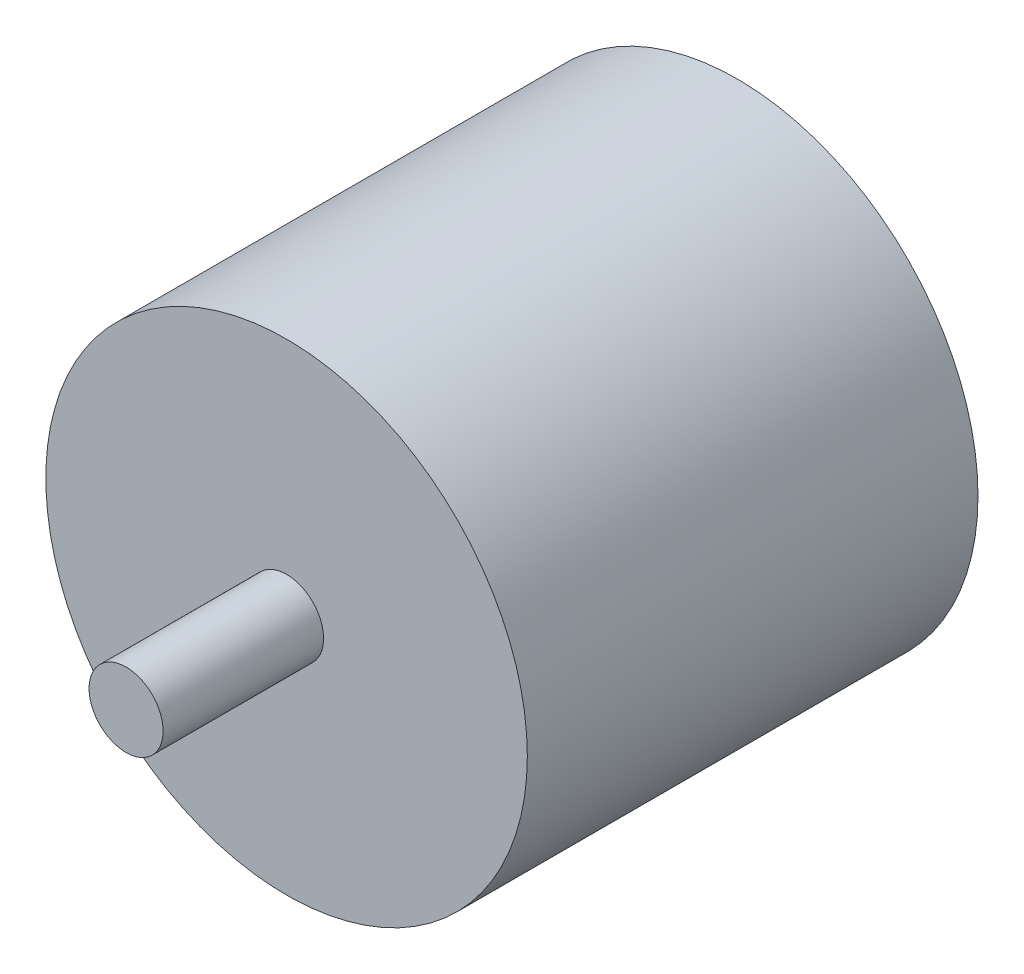
from build123d import *

# Parameters (mm, degrees)
SKETCH1_R           = 19.5
BOSS_EXTRUDE1_DEPTH = 36.5
SKETCH2_R           = 3
BOSS_EXTRUDE2_DEPTH = 13


with BuildPart() as part:
    # Sketch1 → Boss-Extrude1 (new body)
    with BuildSketch(Plane.XY):
        Circle(SKETCH1_R)
    extrude(amount=-BOSS_EXTRUDE1_DEPTH)

    # Sketch2 → Boss-Extrude2 (add)
    with BuildSketch(Plane.XY):
        with Locations(Location((0, 0, 0), (0, 0, 180))):
            Circle(SKETCH2_R)
    extrude(amount=BOSS_EXTRUDE2_DEPTH)


solid = part.part
